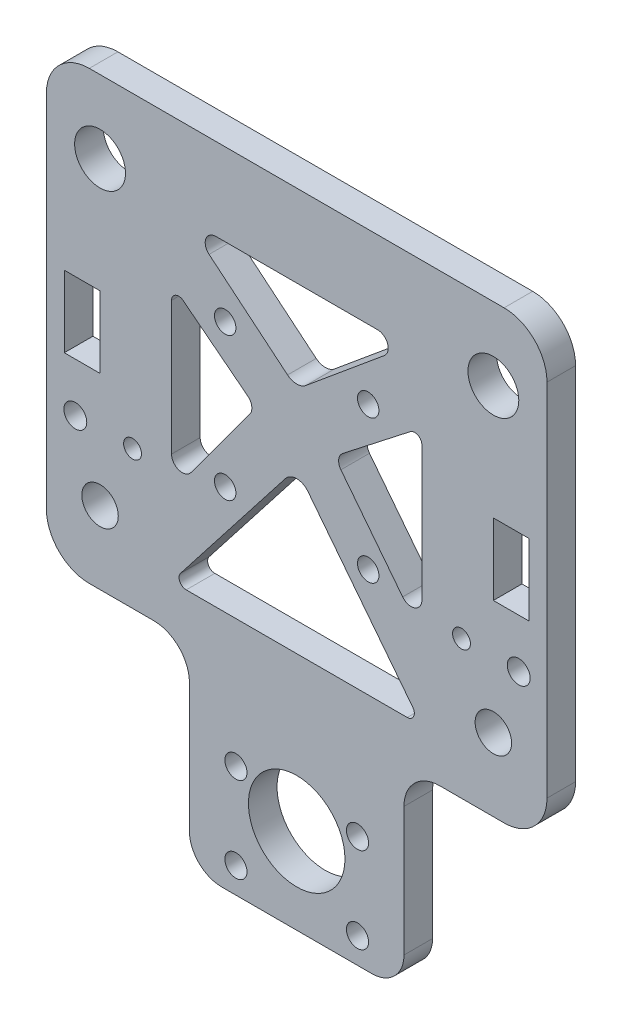
from build123d import *

# Parameters (mm, degrees)
MODEL_R         = 1.25
MODEL_R_2       = 1.6
MODEL_R_3       = 2.55
MODEL_R_4       = 3.556
MODEL_R_5       = 1.5
MODEL_R_6       = 1.55
MODEL_R_7       = 6.75
MODEL_W         = 5
MODEL_H         = 10
EXTRUDE_1_DEPTH = 4


with BuildPart() as part:
    # Model → Бобышка-Вытянуть1 (new body)
    with BuildSketch(Plane.XY):
        with BuildLine():
            Line((-29, 37.192766725), (29, 37.192766725))
            ThreePointArc((29, 37.192766725), (33.242640687, 35.435407412), (35, 31.192766725))
            Line((35, 31.192766725), (35, -19.187803059))
            ThreePointArc((35, -19.187803059), (33.242640687, -23.430443746), (29, -25.187803059))
            Line((29, -25.187803059), (20, -25.187803059))
            ThreePointArc((20, -25.187803059), (16.464466094, -26.652269153), (15, -30.187803059))
            Line((15, -30.187803059), (15, -48.187803059))
            ThreePointArc((15, -48.187803059), (13.681980515, -51.369783574), (10.5, -52.687803059))
            Line((10.5, -52.687803059), (-10.5, -52.687803059))
            ThreePointArc((-10.5, -52.687803059), (-13.681980515, -51.369783574), (-15, -48.187803059))
            Line((-15, -48.187803059), (-15, -30.187803059))
            ThreePointArc((-15, -30.187803059), (-16.464466094, -26.652269153), (-20, -25.187803059))
            Line((-20, -25.187803059), (-29, -25.187803059))
            ThreePointArc((-29, -25.187803059), (-33.242640687, -23.430443746), (-35, -19.187803059))
            Line((-35, -19.187803059), (-35, 31.192766725))
            ThreePointArc((-35, 31.192766725), (-33.242640687, 35.435407412), (-29, 37.192766725))
        make_face()
        with Locations((-22.95502674, -5.842660613)):
            Circle(MODEL_R, mode=Mode.SUBTRACT)
        with Locations((23.04497326, -5.842660613)):
            Circle(MODEL_R, mode=Mode.SUBTRACT)
        with Locations((-30.95502674, -5.842660613)):
            Circle(MODEL_R_2, mode=Mode.SUBTRACT)
        with Locations((31.04497326, -5.842660613)):
            Circle(MODEL_R_2, mode=Mode.SUBTRACT)
        with Locations((-27.5, -15.003318167)):
            Circle(MODEL_R_3, mode=Mode.SUBTRACT)
        with Locations((27.5, 27.008281833)):
            Circle(MODEL_R_4, mode=Mode.SUBTRACT)
        with Locations((-27.5, 27.008281833)):
            Circle(MODEL_R_4, mode=Mode.SUBTRACT)
        with Locations((27.5, -15.003318167)):
            Circle(MODEL_R_3, mode=Mode.SUBTRACT)
        with Locations((-10, -3.997518167)):
            Circle(MODEL_R_5, mode=Mode.SUBTRACT)
        with Locations((10, -3.997518167)):
            Circle(MODEL_R_5, mode=Mode.SUBTRACT)
        with Locations((-10, 16.002481833)):
            Circle(MODEL_R_5, mode=Mode.SUBTRACT)
        with Locations((10, 16.002481833)):
            Circle(MODEL_R_5, mode=Mode.SUBTRACT)
        with Locations((-8.5, -37.087803059)):
            Circle(MODEL_R_6, mode=Mode.SUBTRACT)
        with Locations((8.5, -37.087803059)):
            Circle(MODEL_R_6, mode=Mode.SUBTRACT)
        with Locations((-8.5, -49.087803059)):
            Circle(MODEL_R_6, mode=Mode.SUBTRACT)
        with Locations((0, -40.687803059)):
            Circle(MODEL_R_7, mode=Mode.SUBTRACT)
        with Locations((8.5, -49.087803059)):
            Circle(MODEL_R_6, mode=Mode.SUBTRACT)
        with Locations((-30, 6.002481833)):
            Rectangle(MODEL_W, MODEL_H, mode=Mode.SUBTRACT)
        with Locations((30, 6.002481833)):
            Rectangle(MODEL_W, MODEL_H, mode=Mode.SUBTRACT)
        with BuildLine():
            Line((-15.452005485, -19.187803059), (15.452005485, -19.187803059))
            ThreePointArc((15.452005485, -19.187803059), (16.350604725, -18.626573394), (16.240562864, -17.572841873))
            Line((16.240562864, -17.572841873), (1.577114757, 1.229922372))
            ThreePointArc((1.577114757, 1.229922372), (0, 2), (-1.577114757, 1.229922372))
            Line((-1.577114757, 1.229922372), (-16.240562864, -17.572841873))
            ThreePointArc((-16.240562864, -17.572841873), (-16.350604725, -18.626573394), (-15.452005485, -19.187803059))
        make_face(mode=Mode.SUBTRACT)
        with BuildLine():
            Line((6.179376111, 6.169053374), (14.817163932, -4.907078707))
            ThreePointArc((14.817163932, -4.907078707), (16.487722205, -5.403131571), (17.5, -3.984636928))
            Line((17.5, -3.984636928), (17.5, 14.851722882))
            ThreePointArc((17.5, 14.851722882), (16.938770335, 15.750322122), (15.885038814, 15.640280261))
            Line((15.885038814, 15.640280261), (6.4397704, 8.274331221))
            ThreePointArc((6.4397704, 8.274331221), (5.873555937, 7.275621721), (6.179376111, 6.169053374))
        make_face(mode=Mode.SUBTRACT)
        with BuildLine():
            Line((-17.5, 14.851722882), (-17.5, -3.768193645))
            ThreePointArc((-17.5, -3.768193645), (-16.466952403, -5.193660394), (-14.790726063, -4.655693811))
            Line((-14.790726063, -4.655693811), (-6.96856736, 6.002481833))
            Line((-6.96856736, 6.002481833), (-6.589337275, 6.488764039))
            ThreePointArc((-6.589337275, 6.488764039), (-6.283517101, 7.595332385), (-6.849731564, 8.594041886))
            Line((-6.849731564, 8.594041886), (-15.885038814, 15.640280261))
            ThreePointArc((-15.885038814, 15.640280261), (-16.938770335, 15.750322122), (-17.5, 14.851722882))
        make_face(mode=Mode.SUBTRACT)
        with BuildLine():
            Line((11.296355011, 25.692278611), (-11.296355011, 25.692278611))
            ThreePointArc((-11.296355011, 25.692278611), (-12.707256514, 24.701549606), (-12.254396629, 23.038087873))
            Line((-12.254396629, 23.038087873), (-1.277388824, 13.926569315))
            ThreePointArc((-1.277388824, 13.926569315), (0, 13.465490298), (1.277388824, 13.926569315))
            Line((1.277388824, 13.926569315), (12.254396629, 23.038087873))
            ThreePointArc((12.254396629, 23.038087873), (12.707256514, 24.701549606), (11.296355011, 25.692278611))
        make_face(mode=Mode.SUBTRACT)
    extrude(amount=EXTRUDE_1_DEPTH)


solid = part.part
